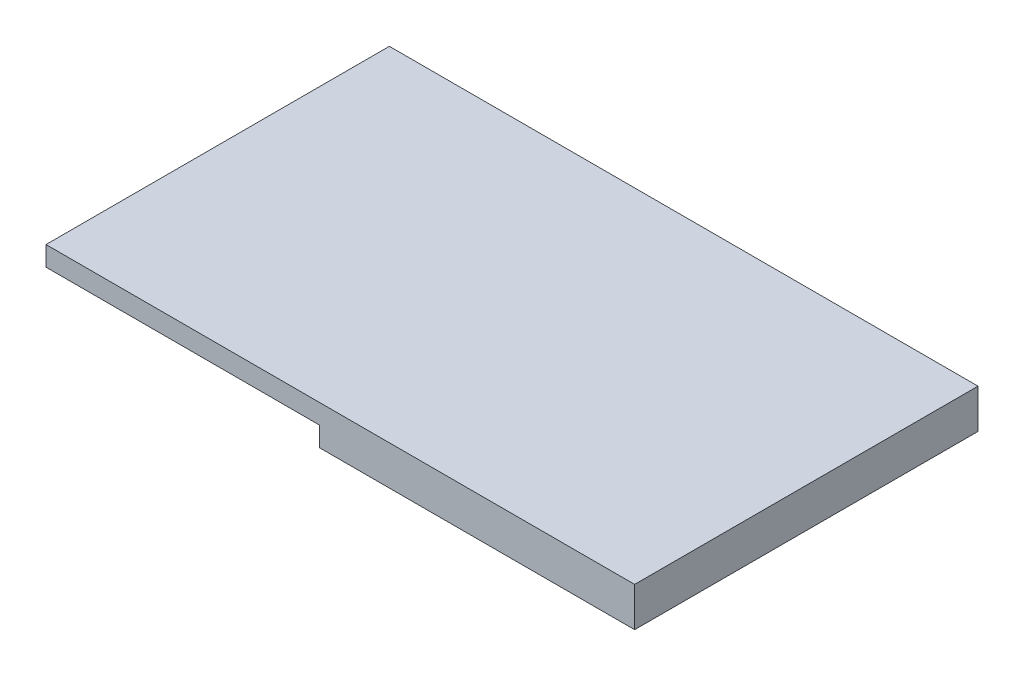
from build123d import *

# Parameters (mm, degrees)
SKETCH1_W           = 60
SKETCH1_H           = 35
BOSS_EXTRUDE1_DEPTH = 4
SKETCH2_W           = 27.885381656
SKETCH2_H           = 35
CUT_EXTRUDE1_DEPTH  = 2


with BuildPart() as part:
    # Sketch1 → Boss-Extrude1 (new body)
    with BuildSketch(Plane(origin=(0, 0, 0), x_dir=(1, 0, 0), z_dir=(0, 1, 0))):
        Rectangle(SKETCH1_W, SKETCH1_H)
    extrude(amount=BOSS_EXTRUDE1_DEPTH)

    # Sketch2 → Cut-Extrude1 (cut)
    with BuildSketch(Plane.XZ):
        with Locations((-16.057309172, 0)):
            Rectangle(SKETCH2_W, SKETCH2_H)
    extrude(amount=-CUT_EXTRUDE1_DEPTH, mode=Mode.SUBTRACT)


solid = part.part
